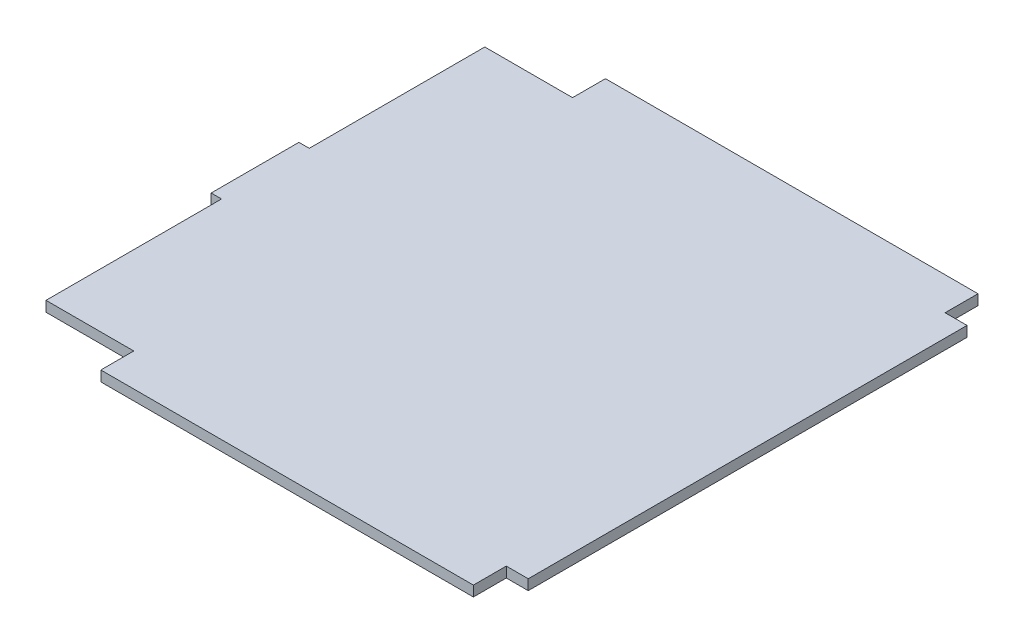
from build123d import *

# Parameters (mm, degrees)
BOSS_EXTRUDE1_DEPTH = 2.9972


with BuildPart() as part:
    # Sketch1 → Boss-Extrude1 (new body)
    with BuildSketch(Plane(origin=(0, 0, 0), x_dir=(1, 0, 0), z_dir=(0, 1, 0))):
        Polygon((-44.3865, -73.025), (63.4365, -73.025), (63.4365, -63.5), (69.7865, -63.5), (69.7865, 63.5), (63.4365, 63.5), (63.4365, 73.025), (-44.3865, 73.025), (-44.3865, 63.5), (-69.7865, 63.5), (-69.7865, 12.7), (-72.7837, 12.7), (-72.7837, -12.7), (-69.7865, -12.7), (-69.7865, -63.5), (-44.3865, -63.5), align=None)
    extrude(amount=BOSS_EXTRUDE1_DEPTH)


solid = part.part
